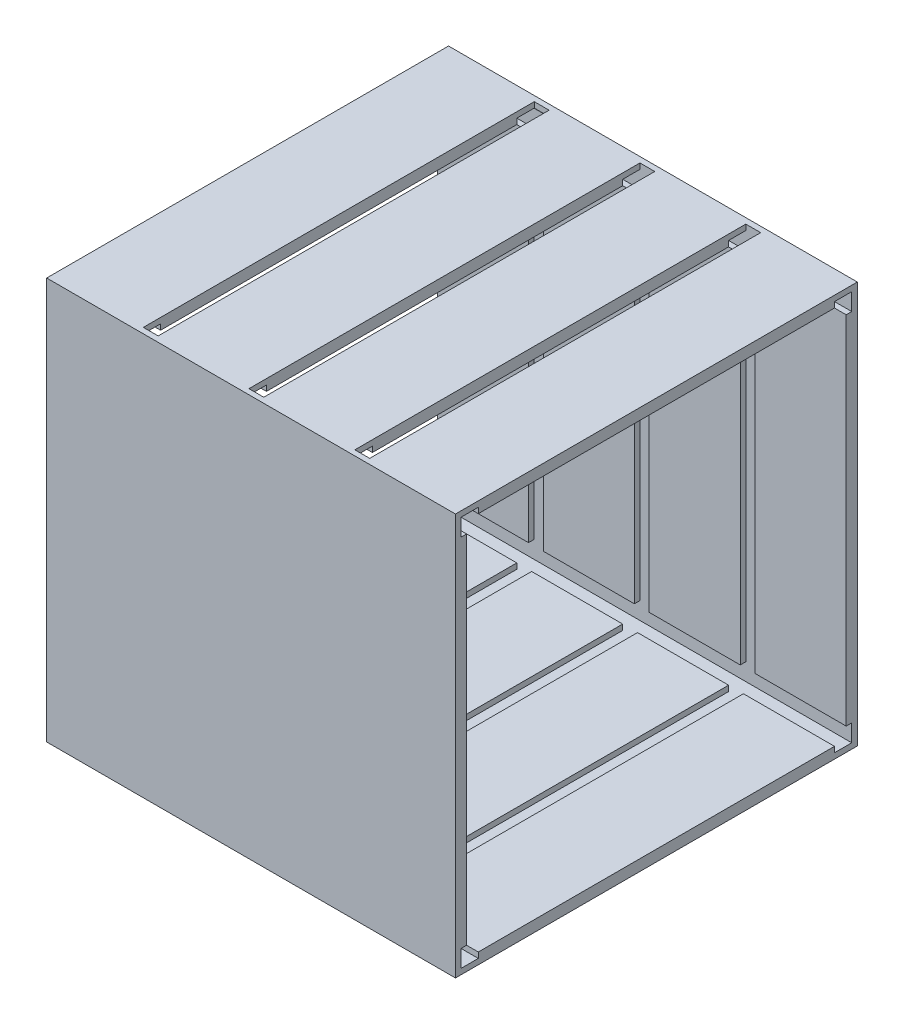
from build123d import *

# Parameters (mm, degrees)
SKETCH1_W            = 688.1
SKETCH1_H            = 688.1
SKETCH1_W_2          = 650
SKETCH1_H_2          = 650
BOSS_EXTRUDE1_DEPTH  = 700
SKETCH3_W            = 25.4
SKETCH3_H            = 650
CUT_EXTRUDE1_DEPTH   = 9.525
SKETCH4_W            = 25.4
SKETCH4_H            = 669.5
SKETCH4_H_2          = 669.05
CUT_EXTRUDE3_DEPTH   = 9.525
SKETCH6_W            = 25.4
SKETCH6_H            = 669.5
CUT_EXTRUDE4_DEPTH   = 9.525
CUT_EXTRUDE5_DEPTH   = 700
MIRROR6_COPY_1_DEPTH = 700


with BuildPart() as part:
    # Sketch1 → Boss-Extrude1 (new body)
    with BuildSketch(Plane(origin=(0, 0, 0), x_dir=(0, 0, -1), z_dir=(1, 0, 0))):
        with Locations((344.05, 344.05)):
            Rectangle(SKETCH1_W, SKETCH1_H)
        with Locations((344.05, 344.05)):
            Rectangle(SKETCH1_W_2, SKETCH1_H_2, mode=Mode.SUBTRACT)
    extrude(amount=BOSS_EXTRUDE1_DEPTH)

    # Sketch3 → Cut-Extrude1 (cut)
    with BuildSketch(Plane.XY.offset(-669.05)):
        with Locations((168.65, 344.05)):
            Rectangle(SKETCH3_W, SKETCH3_H)
        with Locations((350, 344.05)):
            Rectangle(SKETCH3_W, SKETCH3_H)
        with Locations((531.35, 344.05)):
            Rectangle(SKETCH3_W, SKETCH3_H)
    cut_extrude1 = extrude(amount=-CUT_EXTRUDE1_DEPTH, mode=Mode.SUBTRACT)

    # Mirror2: Cut-Extrude1 across plane
    add(cut_extrude1.mirror(Plane(origin=(0, 0, -344.05), x_dir=(1, 0, 0), z_dir=(0, 0, -1))), mode=Mode.SUBTRACT)

    # Sketch4 → Cut-Extrude3 (cut)
    with BuildSketch(Plane(origin=(0, 19.05, 0), x_dir=(1, 0, 0), z_dir=(0, 1, 0))):
        with Locations((168.65, 343.825)):
            Rectangle(SKETCH4_W, SKETCH4_H)
        with Locations((350, 343.825)):
            Rectangle(SKETCH4_W, SKETCH4_H)
        with Locations((531.35, 344.05)):
            Rectangle(SKETCH4_W, SKETCH4_H_2)
    cut_extrude3 = extrude(amount=-CUT_EXTRUDE3_DEPTH, mode=Mode.SUBTRACT)

    # Mirror4: Cut-Extrude3 across plane
    add(cut_extrude3.mirror(Plane.ZX.offset(344.05)), mode=Mode.SUBTRACT)

    # Sketch6 → Cut-Extrude4 (cut)
    with BuildSketch(Plane(origin=(0, 688.1, 0), x_dir=(1, 0, 0), z_dir=(0, 1, 0))):
        with Locations((168.65, 344.275)):
            Rectangle(SKETCH6_W, SKETCH6_H)
        with Locations((350, 343.825)):
            Rectangle(SKETCH6_W, SKETCH6_H)
        with Locations((531.35, 343.825)):
            Rectangle(SKETCH6_W, SKETCH6_H)
    extrude(amount=-CUT_EXTRUDE4_DEPTH, mode=Mode.SUBTRACT)

    # Sketch7 → Cut-Extrude5 (cut)
    with BuildSketch(Plane.ZY):
        Polygon((-19.05, 39.05), (-9.525, 39.05), (-9.525, 9.525), (-39.05, 9.525), (-39.05, 19.05), (-19.05, 19.05), align=None)
    cut_extrude5 = extrude(amount=-CUT_EXTRUDE5_DEPTH, mode=Mode.SUBTRACT)

    # Mirror5: Cut-Extrude5 across plane
    add(cut_extrude5.mirror(Plane(origin=(0, 0, -344.05), x_dir=(1, 0, 0), z_dir=(0, 0, -1))), mode=Mode.SUBTRACT)

    # Mirror6: Cut-Extrude5 across plane
    add(cut_extrude5.mirror(Plane.ZX.offset(344.05)), mode=Mode.SUBTRACT)

    # Mirror6 copy 1 sketch → Mirror6 copy 1 (cut)
    with BuildSketch(Plane(origin=(0, 688.1, -688.1), x_dir=(0, 0, -1), z_dir=(-1, 0, 0))):
        Polygon((-19.05, 39.05), (-9.525, 39.05), (-9.525, 9.525), (-39.05, 9.525), (-39.05, 19.05), (-19.05, 19.05), align=None)
    extrude(amount=-MIRROR6_COPY_1_DEPTH, mode=Mode.SUBTRACT)


solid = part.part
